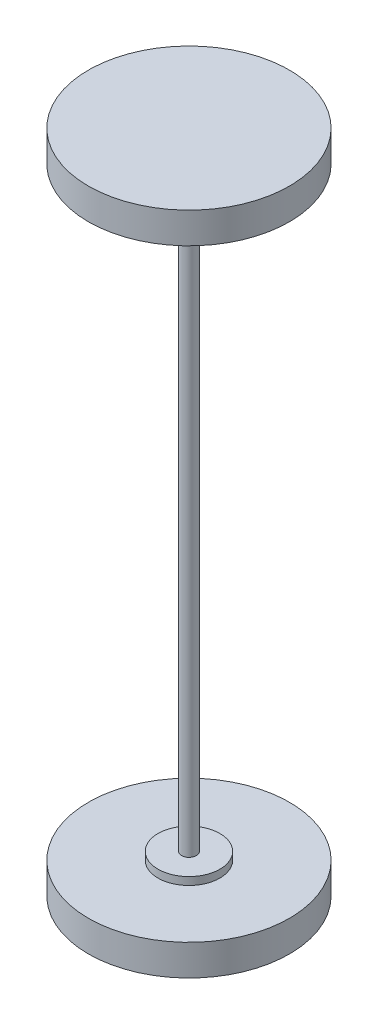
from build123d import *

# Parameters (mm, degrees)
SKETCH1_R           = 32.5
BOSS_EXTRUDE1_DEPTH = 5
SKETCH2_R           = 10
BOSS_EXTRUDE2_DEPTH = 2.5
SKETCH3_R           = 2.4
BOSS_EXTRUDE3_DEPTH = 95


with BuildPart() as part:
    # Sketch1 → Boss-Extrude1 (new, symmetric)
    with BuildSketch(Plane(origin=(0, 0, 0), x_dir=(1, 0, 0), z_dir=(0, 1, 0))):
        with Locations(Location((0, 0, 0), (0, 0, 270))):
            Circle(SKETCH1_R)
    extrude(amount=BOSS_EXTRUDE1_DEPTH, both=True)

    # Sketch2 → Boss-Extrude2 (add, symmetric)
    with BuildSketch(Plane(origin=(0, 5, 0), x_dir=(1, 0, 0), z_dir=(0, 1, 0))):
        with Locations(Location((0, 0, 0), (0, 0, 270))):
            Circle(SKETCH2_R)
    extrude(amount=BOSS_EXTRUDE2_DEPTH, both=True)

    # Sketch3 → Boss-Extrude3 (add)
    with BuildSketch(Plane(origin=(0, 7.5, 0), x_dir=(1, 0, 0), z_dir=(0, 1, 0))):
        with Locations(Location((0, 0, 0), (0, 0, 270))):
            Circle(SKETCH3_R)
    extrude(amount=BOSS_EXTRUDE3_DEPTH)

    # Mirror7: part across plane


with BuildPart() as part_1:
    add(part.part)
    add(part.part.mirror(Plane.ZX.offset(102.5)))


solid = part_1.part
